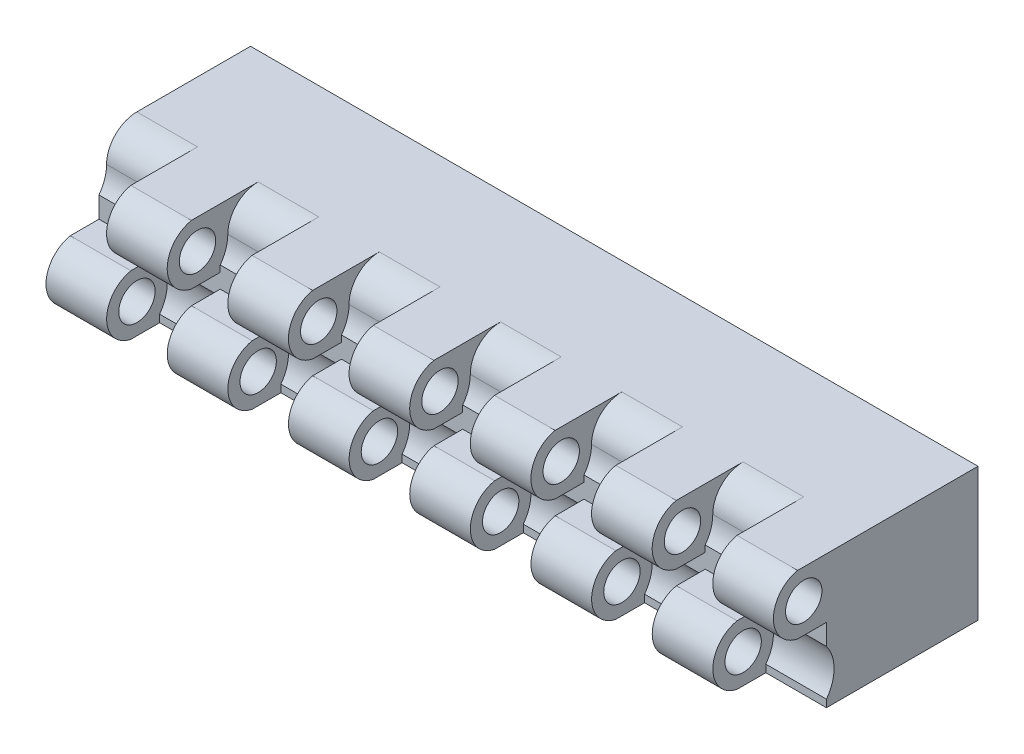
from build123d import *

# Parameters (mm, degrees)
SKETCH1_W           = 25
SKETCH1_H           = 22
BOSS_EXTRUDE1_DEPTH = 60
CUT_EXTRUDE2_REACH  = 123.15
CUT_EXTRUDE3_REACH  = 123.15
SKETCH6_R           = 6.26
FILLET1_R           = 5
SKETCH2_R           = 3
BOSS_EXTRUDE2_DEPTH = 10
LPATTERN1_COUNT     = 6
LPATTERN1_PITCH     = 20
SKETCH3_R           = 3
BOSS_EXTRUDE3_DEPTH = 10
LPATTERN2_COUNT     = 6
LPATTERN2_PITCH     = 20
SKETCH4_R           = 8
SKETCH4_W           = 3
SKETCH4_H           = 11
CUT_EXTRUDE1_DEPTH  = 15


with BuildPart() as part:
    # Sketch1 → Boss-Extrude1 (new, symmetric)
    with BuildSketch(Plane(origin=(0, 0, 0), x_dir=(0, 0, -1), z_dir=(1, 0, 0))):
        Rectangle(SKETCH1_W, SKETCH1_H)
    extrude(amount=BOSS_EXTRUDE1_DEPTH, both=True)

    # Sketch5 → Cut-Extrude2 (cut, up to next)
    with BuildSketch(Plane(origin=(60, 0, 0), x_dir=(0, 0, -1), z_dir=(1, 0, 0)), mode=Mode.PRIVATE) as cut_extrude2_sk1:
        with BuildLine():
            Line((-13.743342576, 11), (-11.25, 11))
            Line((-11.25, 11), (-11.25, 6.005))
            ThreePointArc((-11.25, 6.005), (-23.092030441, 3.213639122), (-13.743342576, 11))
        make_face()
    cut_extrude2_tool1 = extrude(cut_extrude2_sk1.sketch, amount=-CUT_EXTRUDE2_REACH, mode=Mode.PRIVATE) & part.part
    add(cut_extrude2_tool1.solids().sort_by_distance((60, 6.117758, 17.335764))[0], mode=Mode.SUBTRACT)

    # Sketch6 → Cut-Extrude3 (cut, up to next)
    with BuildSketch(Plane.ZY.offset(60), mode=Mode.PRIVATE) as cut_extrude3_sk1:
        with Locations((17.5, -6.005)):
            Circle(SKETCH6_R)
    cut_extrude3_tool1 = extrude(cut_extrude3_sk1.sketch, amount=-CUT_EXTRUDE3_REACH, mode=Mode.PRIVATE) & part.part
    add(cut_extrude3_tool1.solids().sort_by_distance((-60, -6.005, 17.5))[0], mode=Mode.SUBTRACT)

    # Fillet1
    fillet1_edges = [part.edges().sort_by_distance(p)[0] for p in [
        (0, 11, 11.25),
    ]]
    fillet(fillet1_edges, radius=FILLET1_R)

    # Sketch2 → Boss-Extrude2 (add)
    with BuildSketch(Plane(origin=(60, 0, 0), x_dir=(0, 0, -1), z_dir=(1, 0, 0))):
        with BuildLine():
            Line((-17.250000617, 1.202041029), (-6.000000617, 1.202041029))
            Line((-6.000000617, 1.202041029), (-6.000000617, 11))
            Line((-6.000000617, 11), (-17.250000617, 11))
            ThreePointArc((-17.250000617, 11), (-21.250000617, 6.101020514), (-17.250000617, 1.202041029))
        make_face()
        with Locations((-16.250000617, 6.101020514)):
            Circle(SKETCH2_R, mode=Mode.SUBTRACT)
    boss_extrude2 = extrude(amount=-BOSS_EXTRUDE2_DEPTH)

    # LPattern1: Boss-Extrude2 ×6
    with Locations(*[(-i * LPATTERN1_PITCH, 0, 0) for i in range(1, LPATTERN1_COUNT)]):
        add(boss_extrude2)

    # Sketch3 → Boss-Extrude3 (add)
    with BuildSketch(Plane.ZY.offset(60)):
        with BuildLine():
            Line((17.24, -1.202041029), (12.5, -1.202041029))
            Line((12.5, -1.202041029), (12.5, -2.238356932))
            ThreePointArc((12.5, -2.238356932), (11.24, -6.005), (12.5, -9.771643068))
            Line((12.5, -9.771643068), (12.5, -11))
            Line((12.5, -11), (17.24, -11))
            ThreePointArc((17.24, -11), (21.24, -6.101020514), (17.24, -1.202041029))
        make_face()
        with Locations((16.24, -6.101020514)):
            Circle(SKETCH3_R, mode=Mode.SUBTRACT)
    boss_extrude3 = extrude(amount=-BOSS_EXTRUDE3_DEPTH)

    # LPattern2: Boss-Extrude3 ×6
    with Locations(*[(i * LPATTERN2_PITCH, 0, 0) for i in range(1, LPATTERN2_COUNT)]):
        add(boss_extrude3)

    # Sketch4 → Cut-Extrude1 (cut)
    with BuildSketch(Plane(origin=(0, 0, -12.5), x_dir=(-1, 0, 0), z_dir=(0, 0, -1))):
        with Locations(Location((0, 0, 0), (0, 0, 90))):
            Circle(SKETCH4_R)
        with Locations((-14, 0)):
            Rectangle(SKETCH4_W, SKETCH4_H)
        with Locations((14, 0)):
            Rectangle(SKETCH4_W, SKETCH4_H)
    extrude(amount=-CUT_EXTRUDE1_DEPTH, mode=Mode.SUBTRACT)


solid = part.part
